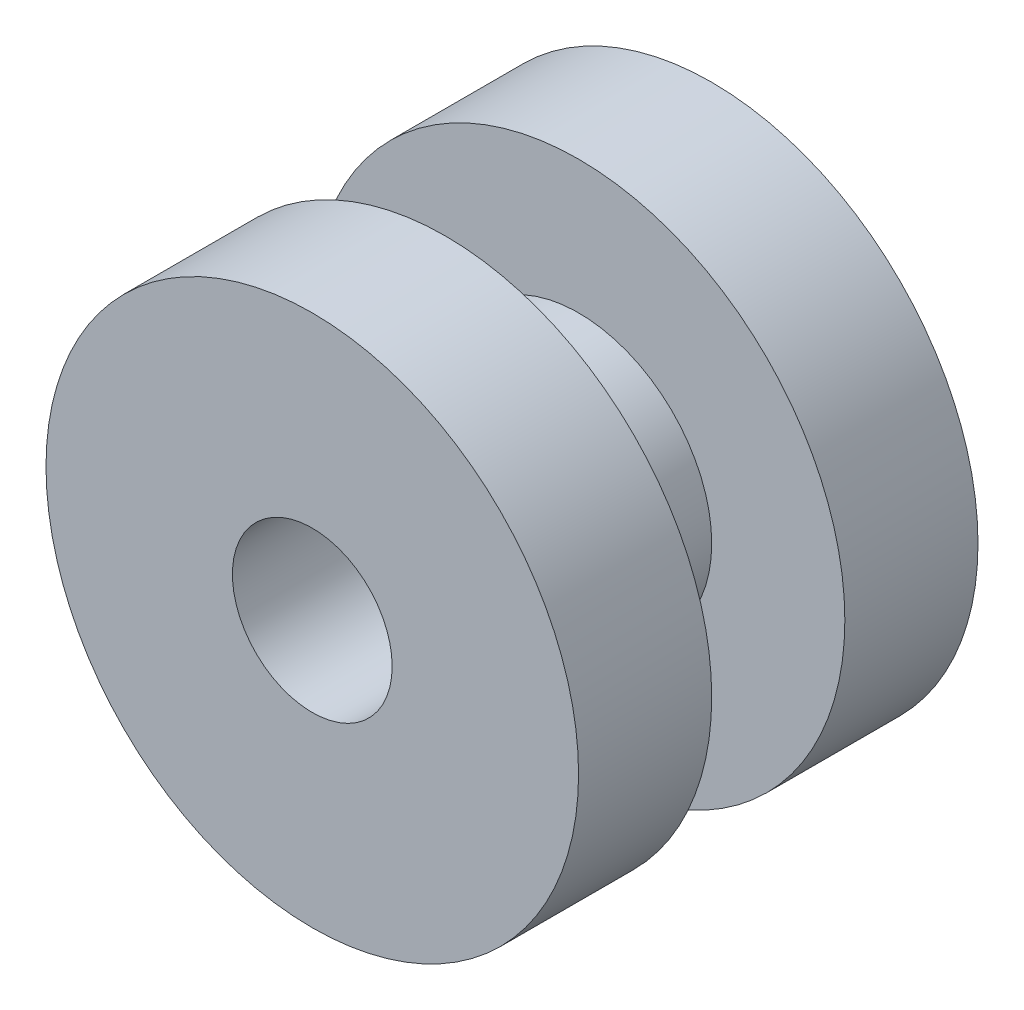
from build123d import *

# Parameters (mm, degrees)
SKETCH1_R           = 10
BOSS_EXTRUDE7_DEPTH = 5
SKETCH8_R           = 5
BOSS_EXTRUDE8_DEPTH = 5
SKETCH9_R           = 10
BOSS_EXTRUDE9_DEPTH = 5
SKETCH10_R          = 3
CUT_EXTRUDE4_DEPTH  = 21.615528128


with BuildPart() as part:
    # Sketch1 → Boss-Extrude7 (new body)
    with BuildSketch(Plane.XY):
        Circle(SKETCH1_R)
    extrude(amount=BOSS_EXTRUDE7_DEPTH)

    # Sketch8 → Boss-Extrude8 (add)
    with BuildSketch(Plane.XY.offset(5)):
        Circle(SKETCH8_R)
    extrude(amount=BOSS_EXTRUDE8_DEPTH)

    # Sketch9 → Boss-Extrude9 (add)
    with BuildSketch(Plane.XY.offset(10)):
        Circle(SKETCH9_R)
    extrude(amount=BOSS_EXTRUDE9_DEPTH)

    # Sketch10 → Cut-Extrude4 (cut, through all)
    with BuildSketch(Plane.XY.offset(15)):
        Circle(SKETCH10_R)
    extrude(amount=-CUT_EXTRUDE4_DEPTH, mode=Mode.SUBTRACT)


solid = part.part
